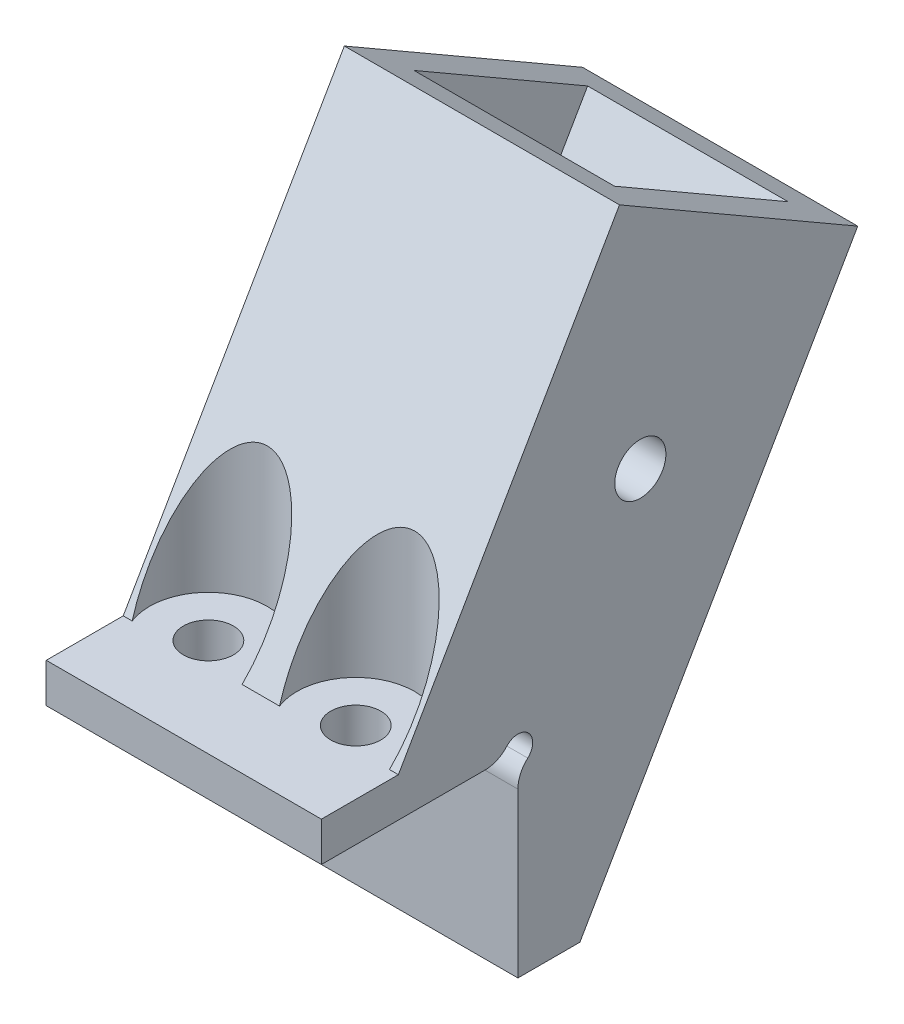
from build123d import *

# Parameters (mm, degrees)
BOSS_EXTRUDE1_DEPTH = 28
BOSS_EXTRUDE2_DEPTH = 28
SKETCH3_R           = 2.55
CUT_EXTRUDE1_DEPTH  = 60.714597447
SKETCH4_R           = 6
CUT_EXTRUDE2_DEPTH  = 28
SKETCH5_W           = 20.4
SKETCH5_H           = 20.4
CUT_EXTRUDE3_DEPTH  = 30
CUT_EXTRUDE4_DEPTH  = 20.4
SKETCH7_R           = 2.6
CUT_EXTRUDE5_DEPTH  = 57.903989341
SKETCH8_R           = 1.5
CUT_EXTRUDE6_DEPTH  = 57.903989341
FILLET2_R           = 3


with BuildPart() as part:
    # Sketch1 → Boss-Extrude1 (new body)
    with BuildSketch(Plane(origin=(0, 0, 0), x_dir=(0, 0, -1), z_dir=(1, 0, 0))):
        Polygon((0, 0), (-24, 0), (-24, -4), (-4, -4), (-4, -24), (0, -24), align=None)
    extrude(amount=BOSS_EXTRUDE1_DEPTH)

    # Sketch2 → Boss-Extrude2 (add)
    with BuildSketch(Plane(origin=(28, 0, 0), x_dir=(0, 0, -1), z_dir=(1, 0, 0))):
        Polygon((2.309401077, -24), (30.582903769, 24.97114317), (6.334192463, 38.97114317), (-16.165807537, 0), (0, 0), (0, -24), align=None)
    extrude(amount=-BOSS_EXTRUDE2_DEPTH)

    # Sketch3 → Cut-Extrude1 (cut, through all)
    with BuildSketch(Plane.XZ.offset(4)):
        with Locations(Location((6.5, 14, 0), (0, 0, 270))):
            Circle(SKETCH3_R)
        with Locations(Location((21.5, 14, 0), (0, 0, 121.860446245))):
            Circle(SKETCH3_R)
    extrude(amount=-CUT_EXTRUDE1_DEPTH, mode=Mode.SUBTRACT)

    # Sketch4 → Cut-Extrude2 (cut)
    with BuildSketch(Plane(origin=(0, 0, 0), x_dir=(1, 0, 0), z_dir=(0, 1, 0))):
        with Locations((6.5, -14)):
            Circle(SKETCH4_R)
        with Locations((21.5, -14)):
            Circle(SKETCH4_R)
    extrude(amount=CUT_EXTRUDE2_DEPTH, mode=Mode.SUBTRACT)

    # Sketch5 → Cut-Extrude3 (cut)
    with BuildSketch(Plane(origin=(0, 31.97114317, -18.458548116), x_dir=(1, 0, 0), z_dir=(0, 0.8660254037844402, -0.49999999999999767))):
        with Locations((14, 0)):
            Rectangle(SKETCH5_W, SKETCH5_H)
    extrude(amount=-CUT_EXTRUDE3_DEPTH, mode=Mode.SUBTRACT)

    # Sketch6 → Cut-Extrude4 (cut)
    with BuildSketch(Plane(origin=(3.8, 0, 0), x_dir=(0, 0, -1), z_dir=(1, 0, 0))):
        Polygon((12.292007234, 0.890381057), (3.458548116, 5.990381057), (3.458548116, -14.409618943), align=None)
    extrude(amount=CUT_EXTRUDE4_DEPTH, mode=Mode.SUBTRACT)

    # Sketch7 → Cut-Extrude5 (cut, through all)
    with BuildSketch(Plane(origin=(28, 0, 0), x_dir=(0, 0, -1), z_dir=(1, 0, 0))):
        with Locations((8.458548116, 14.650635095)):
            Circle(SKETCH7_R)
    extrude(amount=-CUT_EXTRUDE5_DEPTH, mode=Mode.SUBTRACT)

    # Sketch8 → Cut-Extrude6 (cut, through all)
    with BuildSketch(Plane(origin=(28, 0, 0), x_dir=(0, 0, -1), z_dir=(1, 0, 0))):
        with Locations((-4, -4)):
            Circle(SKETCH8_R)
    extrude(amount=-CUT_EXTRUDE6_DEPTH, mode=Mode.SUBTRACT)

    # Fillet2
    fillet2_edges = [part.edges().sort_by_distance(p)[0] for p in [
        (14, -4, 5.5),
        (14, -5.5, 4),
    ]]
    fillet(fillet2_edges, radius=FILLET2_R)


solid = part.part
